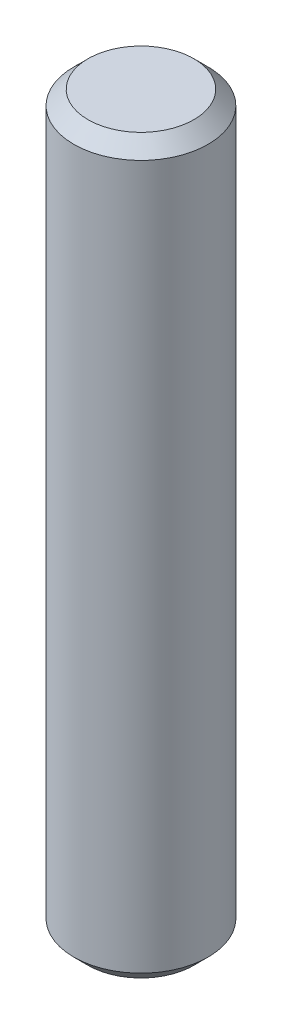
from build123d import *

# Parameters (mm, degrees)
SKETCH1_R           = 1.65
BOSS_EXTRUDE1_DEPTH = 18
CHAMFER1_SIZE       = 0.35


with BuildPart() as part:
    # Sketch1 → Boss-Extrude1 (new body)
    with BuildSketch(Plane(origin=(0, 0, 0), x_dir=(1, 0, 0), z_dir=(0, 1, 0))):
        with Locations(Location((0, 0, 0), (0, 0, 270))):
            Circle(SKETCH1_R)
    extrude(amount=BOSS_EXTRUDE1_DEPTH)

    # Chamfer1
    chamfer1_edges = [part.edges().sort_by_distance(p)[0] for p in [
        (0, 0, -1.65),
        (0, 18, -1.65),
    ]]
    chamfer(chamfer1_edges, length=CHAMFER1_SIZE)


solid = part.part
